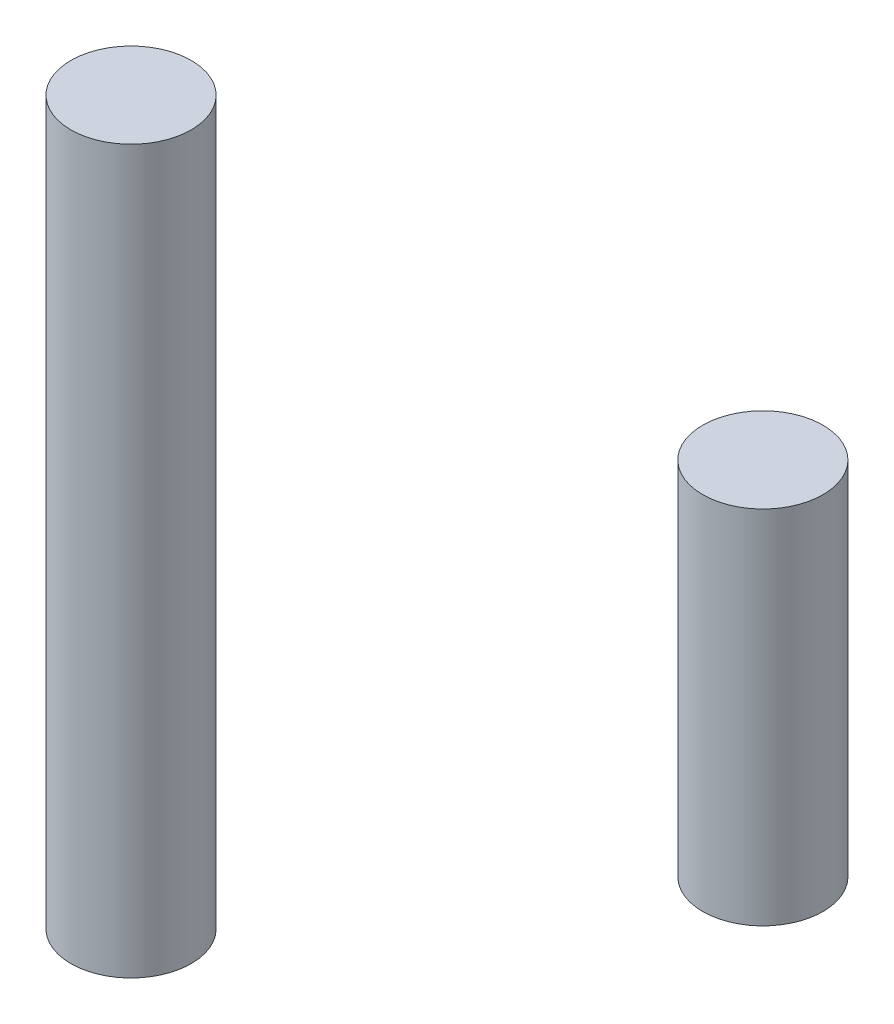
from build123d import *

# Parameters (mm, degrees)
SKETCH1_R           = 2
BOSS_EXTRUDE1_DEPTH = 24
SKETCH2_R           = 2
BOSS_EXTRUDE2_DEPTH = 12


with BuildPart() as part:
    # Sketch1 → Boss-Extrude1 (new body)
    with BuildSketch(Plane(origin=(0, -120.5, 0), x_dir=(1, 0, 0), z_dir=(0, 1, 0))):
        with Locations(Location((-10.5, -26, 0), (0, 0, 270))):
            Circle(SKETCH1_R)
    extrude(amount=BOSS_EXTRUDE1_DEPTH)


with BuildPart() as body_2:
    # Sketch2 → Boss-Extrude2 (new body)
    with BuildSketch(Plane(origin=(0, -108.5, 0), x_dir=(1, 0, 0), z_dir=(0, 1, 0))):
        with Locations(Location((10.5, -26, 0), (0, 0, 270))):
            Circle(SKETCH2_R)
    extrude(amount=BOSS_EXTRUDE2_DEPTH)


solid = Compound([part.part, body_2.part])
